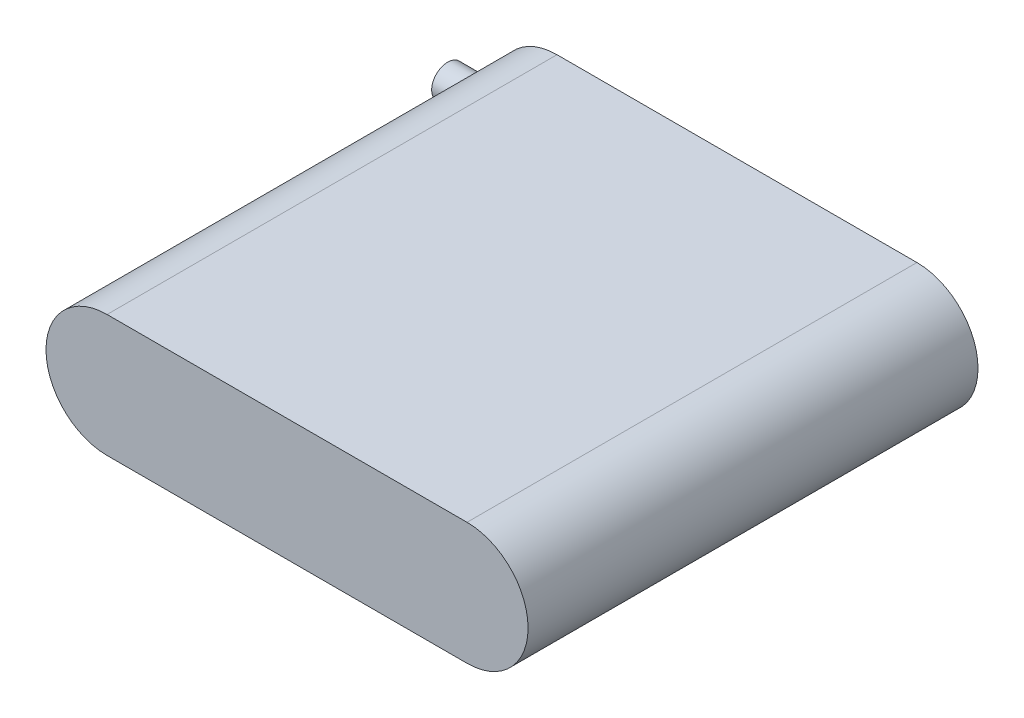
from build123d import *

# Parameters (mm, degrees)
EXTRUDE_1_DEPTH      = 70
EXTRUDE_3_DEPTH      = 5
EXTRUDE_3_DEPTH_BACK = 10
SKETCH_2_R           = 2.5


with BuildPart() as part:
    # 草图1 → 凸台-拉伸1 (new body)
    with BuildSketch(Plane.XY):
        with BuildLine():
            Line((-28, 9.5), (28, 9.5))
            ThreePointArc((28, 9.5), (37.5, 0), (28, -9.5))
            Line((28, -9.5), (-28, -9.5))
            ThreePointArc((-28, -9.5), (-37.5, 0), (-28, 9.5))
        make_face()
    extrude(amount=EXTRUDE_1_DEPTH)

    # 草图2 → 凸台-拉伸3 (add, two sides: drawn at the far end of the back side and taken through both)
    with BuildSketch(Plane.ZY.offset(37.5).offset(-EXTRUDE_3_DEPTH_BACK)):
        with Locations((2.5, 0)):
            Circle(SKETCH_2_R)
    extrude(amount=EXTRUDE_3_DEPTH + EXTRUDE_3_DEPTH_BACK)


solid = part.part
